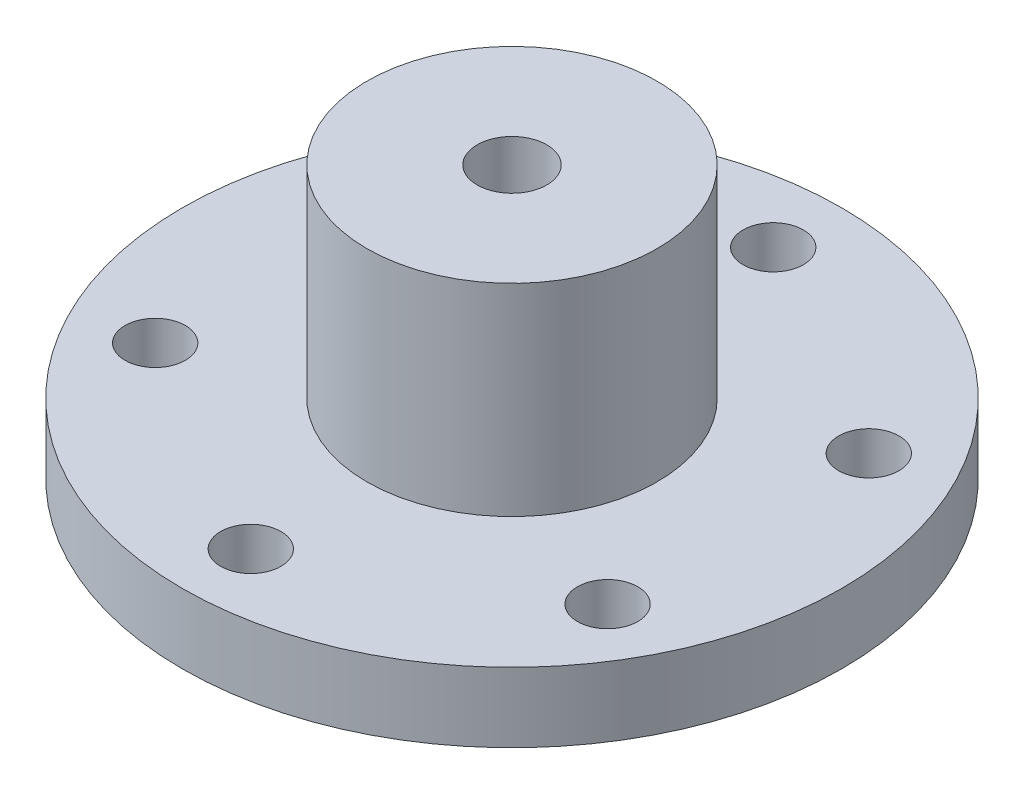
from build123d import *

# Parameters (mm, degrees)
SKETCH_1_R          = 28.4
EXTRUDE_1_DEPTH     = 6
SKETCH_2_R          = 12.5
EXTRUDE_2_DEPTH     = 17.4
SKETCH_3_R          = 3
CUT_EXTRUDE_1_DEPTH = 60
SKETCH_4_R          = 2.6
CUT_EXTRUDE_2_DEPTH = 10


with BuildPart() as part:
    # 草图1 → 凸台-拉伸1 (new body)
    with BuildSketch(Plane(origin=(0, 0, 0), x_dir=(1, 0, 0), z_dir=(0, 1, 0))):
        with Locations(Location((0, 0, 0), (0, 0, 270))):
            Circle(SKETCH_1_R)
    extrude(amount=EXTRUDE_1_DEPTH)

    # 草图2 → 凸台-拉伸2 (add)
    with BuildSketch(Plane(origin=(0, 6, 0), x_dir=(1, 0, 0), z_dir=(0, 1, 0))):
        with Locations(Location((0, 0, 0), (0, 0, 270))):
            Circle(SKETCH_2_R)
    extrude(amount=EXTRUDE_2_DEPTH)

    # 草图3 → 切除-拉伸1 (cut)
    with BuildSketch(Plane(origin=(0, 23.4, 0), x_dir=(1, 0, 0), z_dir=(0, 1, 0))):
        with Locations(Location((0, 0, 0), (0, 0, 270))):
            Circle(SKETCH_3_R)
    extrude(amount=-CUT_EXTRUDE_1_DEPTH, mode=Mode.SUBTRACT)

    # 草图4 → 切除-拉伸2 (cut)
    with BuildSketch(Plane.XZ):
        with Locations(Location((0, 22.5, 0), (0, 0, 270))):
            Circle(SKETCH_4_R)
        with Locations(Location((19.485571585, 11.25, 0), (0, 0, 270))):
            Circle(SKETCH_4_R)
        with Locations(Location((19.485571585, -11.25, 0), (0, 0, 270))):
            Circle(SKETCH_4_R)
        with Locations(Location((0, -22.5, 0), (0, 0, 270))):
            Circle(SKETCH_4_R)
        with Locations(Location((-19.485571585, -11.25, 0), (0, 0, 270))):
            Circle(SKETCH_4_R)
        with Locations(Location((-19.485571585, 11.25, 0), (0, 0, 270))):
            Circle(SKETCH_4_R)
    extrude(amount=-CUT_EXTRUDE_2_DEPTH, mode=Mode.SUBTRACT)


solid = part.part
